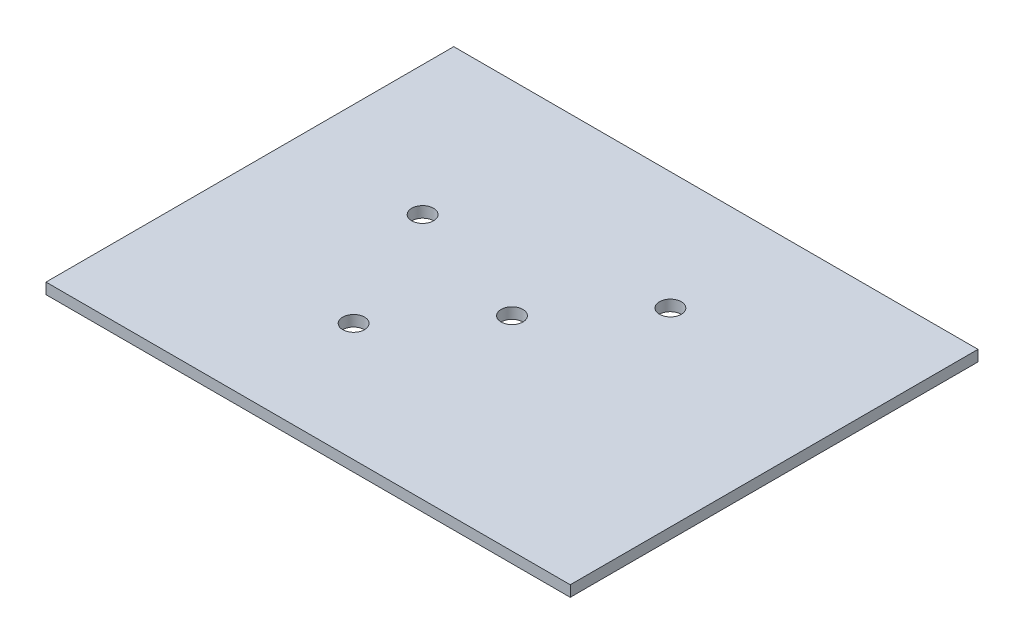
from build123d import *

# Parameters (mm, degrees)
BOSS_EXTRUDE1_DEPTH = 9.525
BOSS_EXTRUDE2_DEPTH = 9.525
SKETCH3_R           = 9.525
CUT_EXTRUDE6_DEPTH  = 587.481888574
SKETCH4_W           = 63.5
SKETCH4_H           = 355.6
BOSS_EXTRUDE3_DEPTH = 9.525


with BuildPart() as part:
    # Sketch1 → Boss-Extrude1 (new body)
    with BuildSketch(Plane(origin=(0, 0, 0), x_dir=(1, 0, 0), z_dir=(0, 1, 0))):
        Polygon((461.512355724, 17.636671785), (558.8, 99.270698215), (558.8, 177.8), (228.6, 177.8), (228.6, -177.8), align=None)
    extrude(amount=BOSS_EXTRUDE1_DEPTH)

    # Sketch1<4> → Boss-Extrude2 (add)
    with BuildSketch(Plane(origin=(0, 0, 0), x_dir=(1, 0, 0), z_dir=(0, 1, 0))):
        Polygon((558.8, -177.8), (558.8, 99.270698215), (461.512355724, 17.636671785), (228.6, -177.8), align=None)
    extrude(amount=BOSS_EXTRUDE2_DEPTH)

    # Sketch3 → Cut-Extrude6 (cut, through all)
    with BuildSketch(Plane.XZ):
        with Locations((456.957959674, -74.868325498)):
            Circle(SKETCH3_R)
        with Locations((393.7, 0)):
            Circle(SKETCH3_R)
        with Locations((330.442040326, 74.868325498)):
            Circle(SKETCH3_R)
        with Locations((278.307280736, -37.446399571)):
            Circle(SKETCH3_R)
    extrude(amount=-CUT_EXTRUDE6_DEPTH, mode=Mode.SUBTRACT)

    # Sketch4 → Boss-Extrude3 (add)
    with BuildSketch(Plane.XZ):
        with Locations((590.55, 0)):
            Rectangle(SKETCH4_W, SKETCH4_H)
        with Locations((196.85, 0)):
            Rectangle(SKETCH4_W, SKETCH4_H)
    extrude(amount=-BOSS_EXTRUDE3_DEPTH)


solid = part.part
